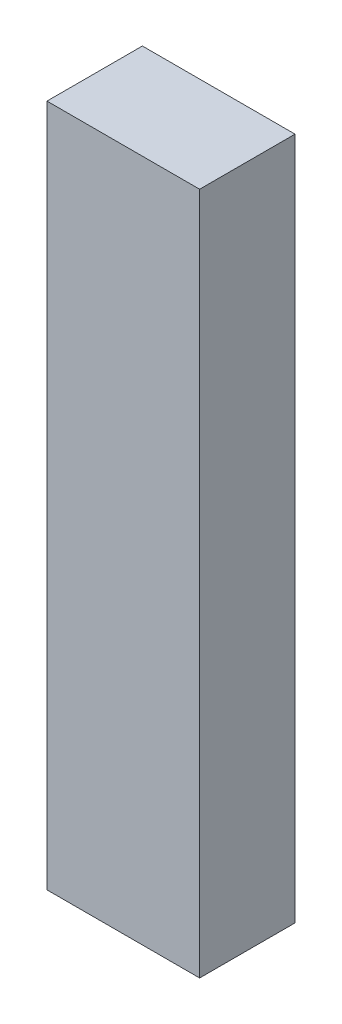
from build123d import *

# Parameters (mm, degrees)
DET_KABLO_KANALI_DILIMI_40X25_1_START = -765
SKETCH1_W                             = 40
SKETCH1_H                             = 179
DET_KABLO_KANALI_DILIMI_40X25_1_DEPTH = 25


with BuildPart() as part:
    # Sketch1 → DET_kablo_kanali_dilimi_40x25_1 (new body)
    with BuildSketch(Plane.XY.offset(DET_KABLO_KANALI_DILIMI_40X25_1_START)):
        with Locations((1318, 1558.5)):
            Rectangle(SKETCH1_W, SKETCH1_H)
    extrude(amount=-DET_KABLO_KANALI_DILIMI_40X25_1_DEPTH)


solid = part.part
